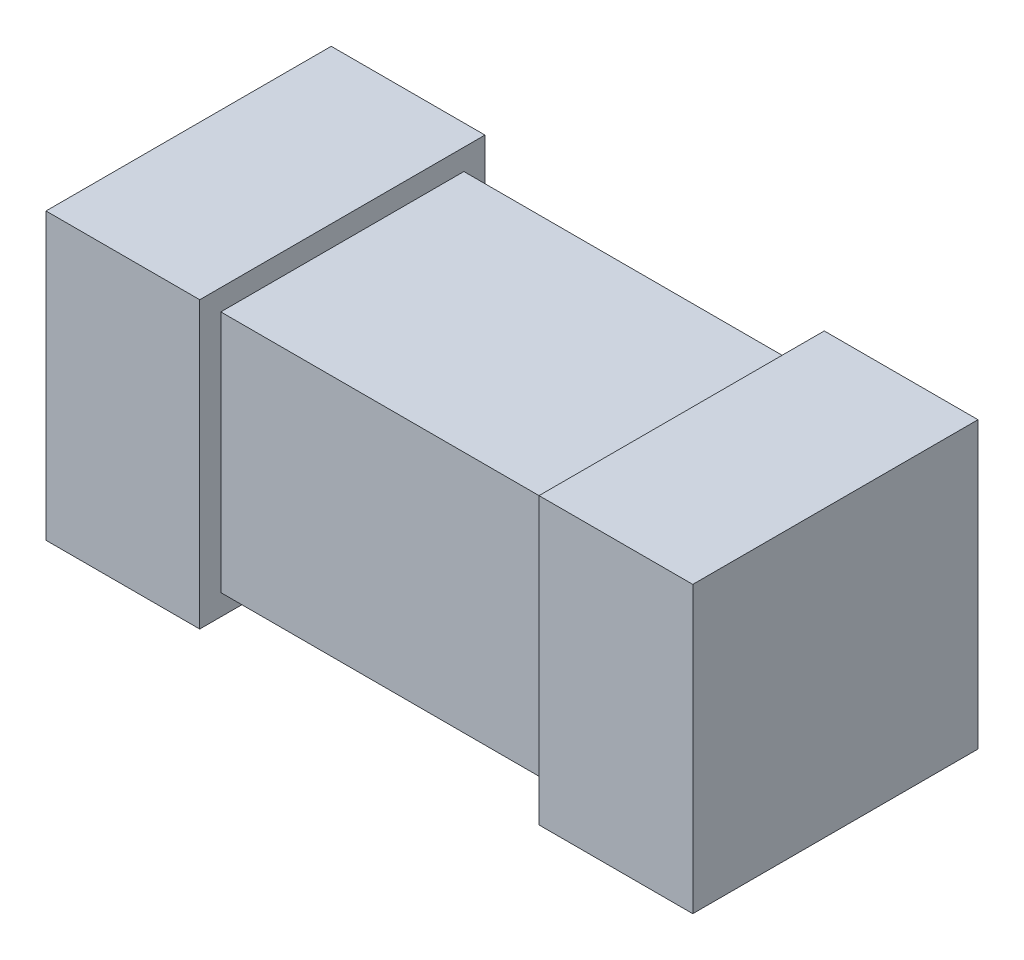
from build123d import *

# Parameters (mm, degrees)
SKETCH_1_W      = 1.45
SKETCH_1_H      = 2.69
EXTRUDE_1_DEPTH = 2.69
SKETCH_2_W      = 2.292603852
SKETCH_2_H      = 2.292603852
EXTRUDE_2_DEPTH = 1.6


with BuildPart() as part:
    # Эскиз1 → Бобышка-Вытянуть1 (new body)
    with BuildSketch(Plane.XY):
        with Locations((2.325, 0)):
            Rectangle(SKETCH_1_W, SKETCH_1_H)
    extrude(amount=EXTRUDE_1_DEPTH)

    # Эскиз2 → Бобышка-Вытянуть2 (add)
    with BuildSketch(Plane.ZY.offset(-1.6)):
        with Locations((1.345, 0)):
            Rectangle(SKETCH_2_W, SKETCH_2_H)
    extrude(amount=EXTRUDE_2_DEPTH)

    # Зеркальное отражение1: part across plane


with BuildPart() as part_1:
    add(part.part)
    add(part.part.mirror(Plane(origin=(0, 0, 0), x_dir=(0, 0, 1), z_dir=(1, 0, 0))))


solid = part_1.part
